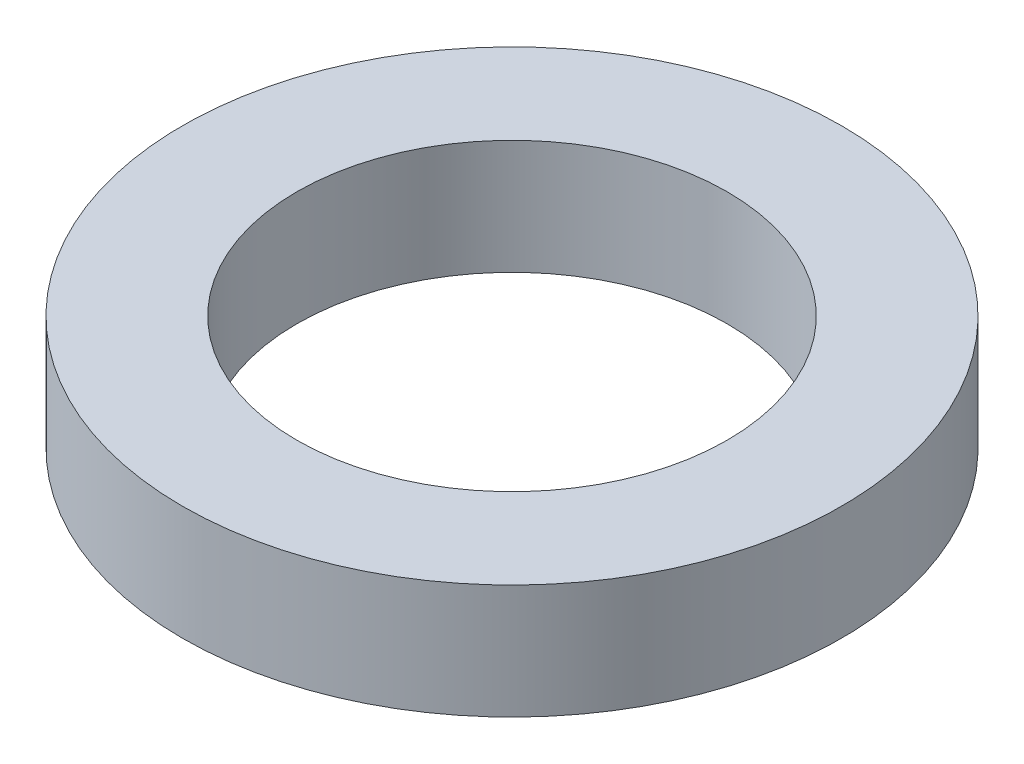
from build123d import *

# Parameters (mm, degrees)
SKETCH1_R      = 44.734
SKETCH1_R_2    = 29.21
EXTRUDE1_DEPTH = 15.524


with BuildPart() as part:
    # Sketch1 → Extrude1 (new body)
    with BuildSketch(Plane(origin=(0, 0, 0), x_dir=(1, 0, 0), z_dir=(0, 1, 0))):
        with Locations(Location((0, 0, 0), (0, 0, 90))):
            Circle(SKETCH1_R)
        with Locations(Location((0, 0, 0), (0, 0, 90))):
            Circle(SKETCH1_R_2, mode=Mode.SUBTRACT)
    extrude(amount=EXTRUDE1_DEPTH)


solid = part.part
